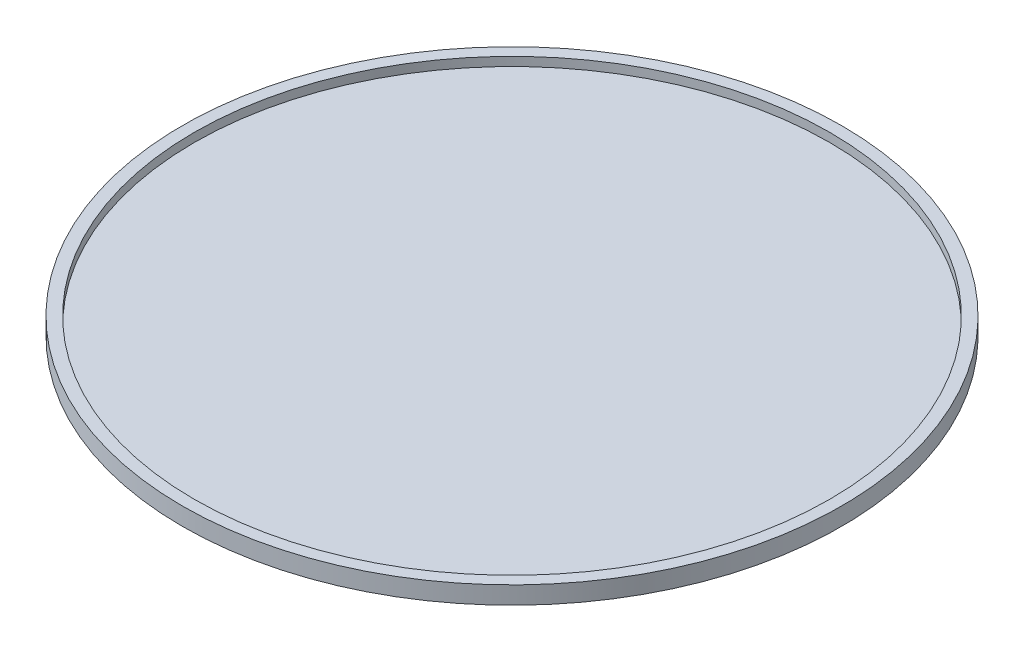
from build123d import *

# Parameters (mm, degrees)
SKETCH1_R           = 28
BOSS_EXTRUDE1_DEPTH = 1.5
SKETCH3_R           = 27
CUT_EXTRUDE1_DEPTH  = 0.75


with BuildPart() as part:
    # Sketch1 → Boss-Extrude1 (new body)
    with BuildSketch(Plane(origin=(0, 0, 0), x_dir=(1, 0, 0), z_dir=(0, 1, 0))):
        with Locations(Location((0, 0, 0), (0, 0, 270))):
            Circle(SKETCH1_R)
    extrude(amount=BOSS_EXTRUDE1_DEPTH)

    # Sketch3 → Cut-Extrude1 (cut)
    with BuildSketch(Plane(origin=(0, 1.5, 0), x_dir=(1, 0, 0), z_dir=(0, 1, 0))):
        with Locations(Location((0, 0, 0), (0, 0, 270))):
            Circle(SKETCH3_R)
    extrude(amount=-CUT_EXTRUDE1_DEPTH, mode=Mode.SUBTRACT)


solid = part.part
